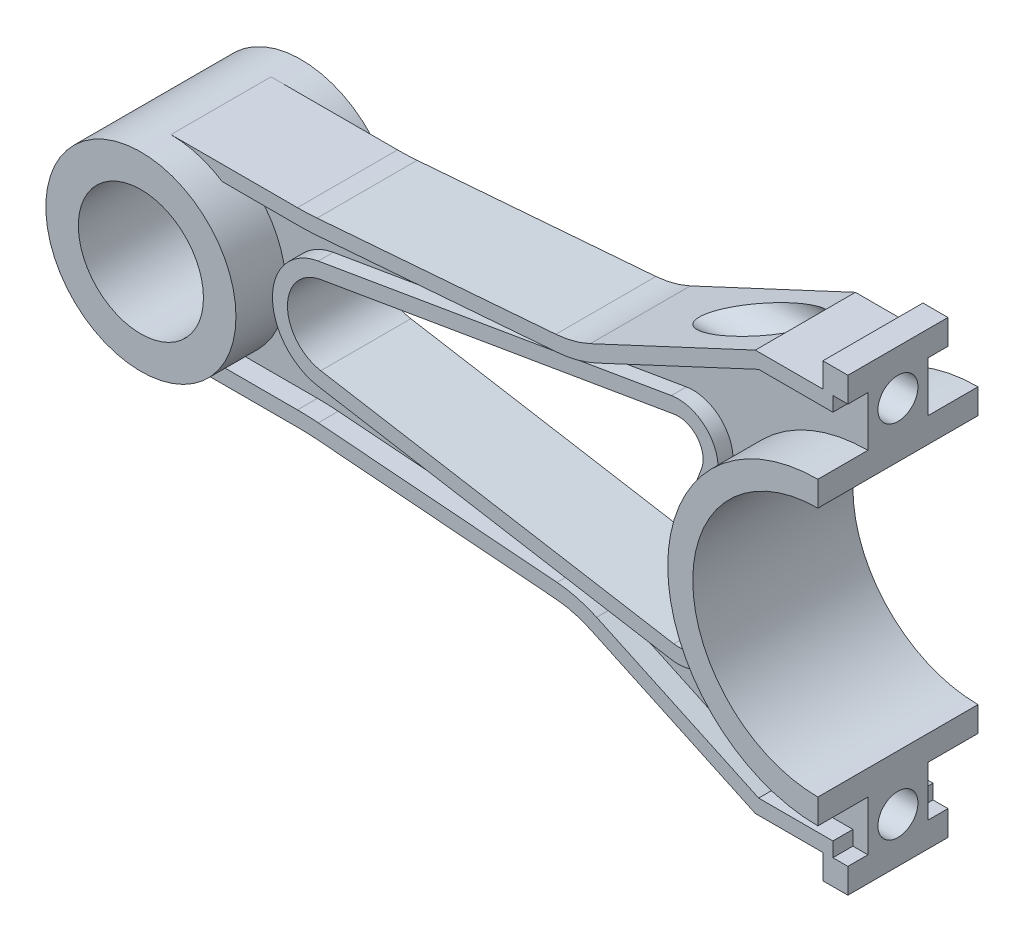
from build123d import *

# Parameters (mm, degrees)
SKETCH1_R           = 12.5
BOSS_EXTRUDE1_DEPTH = 6
SKETCH1_4_R         = 19
SKETCH1_4_R_2       = 12.5
BOSS_EXTRUDE2_DEPTH = 16
BOSS_EXTRUDE3_DEPTH = 10
SKETCH3_R           = 4
CUT_EXTRUDE2_DEPTH  = 18.5
SKETCH4_R           = 5.795
CUT_EXTRUDE4_DEPTH  = 144.94417008
BOSS_EXTRUDE4_DEPTH = 9


with BuildPart() as part:
    # Sketch1 → Boss-Extrude1 (new, symmetric)
    with BuildSketch(Plane.XY):
        with BuildLine():
            Line((-110.00450535, 19), (-135.29, 19))
            ThreePointArc((-135.29, 19), (-154.29, 0), (-135.29, -19))
            Line((-135.29, -19), (-110.00450535, -19))
            ThreePointArc((-110.00450535, -19), (-108.041514562, -19.038548188), (-106.081550564, -19.154133313))
            Line((-106.081550564, -19.154133313), (-58.361460534, -22.909785849))
            ThreePointArc((-58.361460534, -22.909785849), (-54.838603484, -23.507213745), (-51.478277214, -24.721976782))
            Line((-51.478277214, -24.721976782), (-18.5, -40.1))
            Line((-18.5, -40.1), (-5, -40.1))
            Line((-5, -40.1), (-5, -45))
            Line((-5, -45), (0, -45))
            Line((0, -45), (0, -25))
            ThreePointArc((0, -25), (-25, 0), (0, 25))
            Line((0, 25), (0, 45))
            Line((0, 45), (-5, 45))
            Line((-5, 45), (-5, 40.1))
            Line((-5, 40.1), (-18.5, 40.1))
            Line((-18.5, 40.1), (-51.478277214, 24.721976782))
            ThreePointArc((-51.478277214, 24.721976782), (-54.838603484, 23.507213745), (-58.361460534, 22.909785849))
            Line((-58.361460534, 22.909785849), (-106.081550564, 19.154133313))
            ThreePointArc((-106.081550564, 19.154133313), (-108.041514562, 19.038548188), (-110.00450535, 19))
        make_face()
        with BuildLine():
            ThreePointArc((-106.341033016, -7.886801028), (-113, 0), (-106.341033016, 7.886801028))
            Line((-106.341033016, 7.886801028), (-35.770781366, 19.886220952))
            ThreePointArc((-35.770781366, 19.886220952), (-31.0052687, 18.051447358), (-30.336236293, 12.988947901))
            ThreePointArc((-30.336236293, 12.988947901), (-33, 0), (-30.336236293, -12.988947901))
            ThreePointArc((-30.336236293, -12.988947901), (-31.0052687, -18.051447358), (-35.770781366, -19.886220952))
            Line((-35.770781366, -19.886220952), (-106.341033016, -7.886801028))
        make_face(mode=Mode.SUBTRACT)
        with Locations((-135.29, 0)):
            Circle(SKETCH1_R, mode=Mode.SUBTRACT)
    extrude(amount=BOSS_EXTRUDE1_DEPTH, both=True)

    # Sketch1<4> → Boss-Extrude2 (add, symmetric)
    # profile 1 of 2: a face of its own
    with BuildSketch(Plane.XY):
        with Locations((-135.29, 0)):
            Circle(SKETCH1_4_R)
        with Locations((-135.29, 0)):
            Circle(SKETCH1_4_R_2, mode=Mode.SUBTRACT)
    # profile 2 of 2: a face of its own
    with BuildSketch(Plane.XY):
        with BuildLine():
            Line((0, 25), (0, 30))
            ThreePointArc((0, 30), (-30, 0), (0, -30))
            Line((0, -30), (0, -25))
            ThreePointArc((0, -25), (-25, 0), (0, 25))
        make_face()
    extrude(amount=BOSS_EXTRUDE2_DEPTH, both=True)

    # Sketch2 → Boss-Extrude3 (add, symmetric)
    with BuildSketch(Plane.XY):
        with BuildLine():
            Line((-5, 45), (-5, 40.1))
            Line((-5, 40.1), (-18.5, 40.1))
            Line((-18.5, 40.1), (-51.478277214, 24.721976782))
            ThreePointArc((-51.478277214, 24.721976782), (-54.838603484, 23.507213745), (-58.361460534, 22.909785849))
            Line((-58.361460534, 22.909785849), (-106.081550564, 19.154133313))
            ThreePointArc((-106.081550564, 19.154133313), (-108.041514562, 19.038548188), (-110.00450535, 19))
            Line((-110.00450535, 19), (-135.29, 19))
            ThreePointArc((-135.29, 19), (-129.951460874, 18.234582529), (-125.043049234, 16))
            Line((-125.043049234, 16), (-110.00450535, 16))
            ThreePointArc((-110.00450535, 16), (-107.923735115, 16.040861079), (-105.846173277, 16.163381312))
            Line((-105.846173277, 16.163381312), (-58.126083247, 19.919033847))
            ThreePointArc((-58.126083247, 19.919033847), (-54.07479764, 20.606075928), (-50.210422429, 22.003053421))
            Line((-50.210422429, 22.003053421), (-17.834916012, 37.1))
            Line((-17.834916012, 37.1), (-3, 37.1))
            Line((-3, 37.1), (-3, 40))
            Line((-3, 40), (0, 40))
            Line((0, 40), (0, 45))
            Line((0, 45), (-5, 45))
        make_face()
        with BuildLine():
            Line((0, -40), (-3, -40))
            Line((-3, -40), (-3, -37.1))
            Line((-3, -37.1), (-17.834916012, -37.1))
            Line((-17.834916012, -37.1), (-50.210422429, -22.003053421))
            ThreePointArc((-50.210422429, -22.003053421), (-54.07479764, -20.606075928), (-58.126083247, -19.919033847))
            Line((-58.126083247, -19.919033847), (-105.846173277, -16.163381312))
            ThreePointArc((-105.846173277, -16.163381312), (-107.923735115, -16.040861079), (-110.00450535, -16))
            Line((-110.00450535, -16), (-125.043049234, -16))
            ThreePointArc((-125.043049234, -16), (-129.951460874, -18.234582529), (-135.29, -19))
            Line((-135.29, -19), (-110.00450535, -19))
            ThreePointArc((-110.00450535, -19), (-108.041514562, -19.038548188), (-106.081550564, -19.154133313))
            Line((-106.081550564, -19.154133313), (-58.361460534, -22.909785849))
            ThreePointArc((-58.361460534, -22.909785849), (-54.838603484, -23.507213745), (-51.478277214, -24.721976782))
            Line((-51.478277214, -24.721976782), (-18.5, -40.1))
            Line((-18.5, -40.1), (-5, -40.1))
            Line((-5, -40.1), (-5, -45))
            Line((-5, -45), (0, -45))
            Line((0, -45), (0, -40))
        make_face()
    extrude(amount=BOSS_EXTRUDE3_DEPTH, both=True)

    # Sketch3 → Cut-Extrude2 (cut)
    with BuildSketch(Plane(origin=(0, 0, 0), x_dir=(0, 0, -1), z_dir=(1, 0, 0))):
        with Locations((0, -36)):
            Circle(SKETCH3_R)
    cut_extrude2 = extrude(amount=-CUT_EXTRUDE2_DEPTH, mode=Mode.SUBTRACT)

    # Sketch4 → Cut-Extrude4 (cut, through all)
    with BuildSketch(Plane(origin=(-18.5, 0, 0), x_dir=(0, 0, -1), z_dir=(1, 0, 0))):
        with Locations((0, -36)):
            Circle(SKETCH4_R)
    cut_extrude4 = extrude(amount=-CUT_EXTRUDE4_DEPTH, mode=Mode.SUBTRACT)

    # Mirror1: Cut-Extrude2, Cut-Extrude4 across plane
    add(cut_extrude2.mirror(Plane.ZX), mode=Mode.SUBTRACT)
    add(cut_extrude4.mirror(Plane.ZX), mode=Mode.SUBTRACT)

    # Sketch5 → Boss-Extrude4 (add, symmetric)
    with BuildSketch(Plane.XY):
        with BuildLine():
            Line((-106.843920397, 10.844351413), (-36.273668747, 22.843771338))
            ThreePointArc((-36.273668747, 22.843771338), (-28.648848481, 19.908133587), (-27.57839663, 11.808134455))
            ThreePointArc((-27.57839663, 11.808134455), (-30, 0), (-27.57839663, -11.808134455))
            ThreePointArc((-27.57839663, -11.808134455), (-28.648848481, -19.908133587), (-36.273668747, -22.843771338))
            Line((-36.273668747, -22.843771338), (-106.843920397, -10.844351413))
            ThreePointArc((-106.843920397, -10.844351413), (-116, 0), (-106.843920397, 10.844351413))
        make_face()
        with BuildLine():
            Line((-106.341033016, -7.886801028), (-35.770781366, -19.886220952))
            ThreePointArc((-35.770781366, -19.886220952), (-31.0052687, -18.051447358), (-30.336236293, -12.988947901))
            ThreePointArc((-30.336236293, -12.988947901), (-33, 0), (-30.336236293, 12.988947901))
            ThreePointArc((-30.336236293, 12.988947901), (-31.0052687, 18.051447358), (-35.770781366, 19.886220952))
            Line((-35.770781366, 19.886220952), (-106.341033016, 7.886801028))
            ThreePointArc((-106.341033016, 7.886801028), (-113, 0), (-106.341033016, -7.886801028))
        make_face(mode=Mode.SUBTRACT)
    extrude(amount=BOSS_EXTRUDE4_DEPTH, both=True)


solid = part.part
